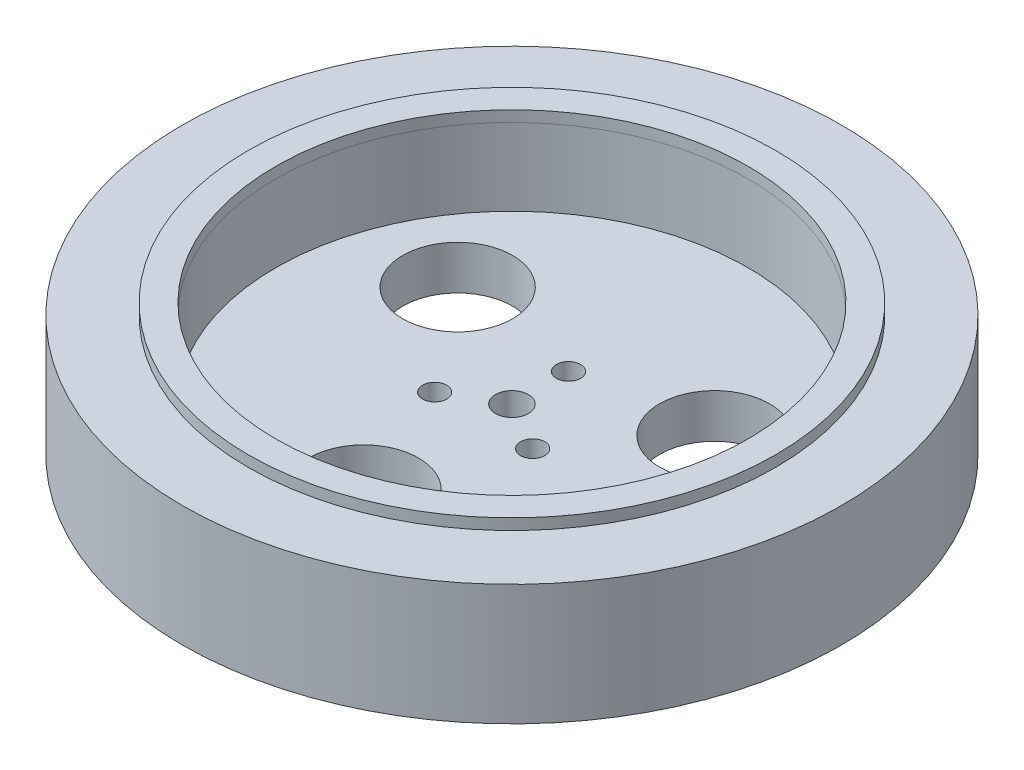
from build123d import *

# Parameters (mm, degrees)
SKETCH_1_R          = 24
EXTRUDE_1_DEPTH     = 12
SKETCH_2_R          = 21.5
CUT_EXTRUDE_3_DEPTH = 7
SKETCH_3_R          = 1.1
SKETCH_3_R_2        = 1.5
CUT_EXTRUDE_4_DEPTH = 35.655446902
SKETCH_5_R          = 30
SKETCH_5_R_2        = 24
EXTRUDE_2_DEPTH     = 11
SKETCH_7_R          = 24
CUT_EXTRUDE_6_DEPTH = 1
SKETCH_8_R          = 24
SKETCH_8_R_2        = 21.5
EXTRUDE_4_DEPTH     = 1
SKETCH_4_R          = 5
CUT_EXTRUDE_8_DEPTH = 44.17406629


with BuildPart() as part:
    # 草图1 → 凸台-拉伸1 (new body)
    with BuildSketch(Plane(origin=(0, 0, 0), x_dir=(1, 0, 0), z_dir=(0, 1, 0))):
        with Locations(Location((0, 0, 0), (0, 0, 270))):
            Circle(SKETCH_1_R)
    extrude(amount=EXTRUDE_1_DEPTH)

    # 草图2 → 切除-拉伸3 (cut)
    with BuildSketch(Plane(origin=(0, 12, 0), x_dir=(1, 0, 0), z_dir=(0, 1, 0))):
        with Locations(Location((0, 0, 0), (0, 0, 270))):
            Circle(SKETCH_2_R)
    extrude(amount=-CUT_EXTRUDE_3_DEPTH, mode=Mode.SUBTRACT)

    # 草图3 → 切除-拉伸4 (cut, through all)
    with BuildSketch(Plane(origin=(0, 5, 0), x_dir=(1, 0, 0), z_dir=(0, 1, 0))):
        with Locations(Location((0, 5.15, 0), (0, 0, 270))):
            Circle(SKETCH_3_R)
        with Locations(Location((4.460030829, -2.575, 0), (0, 0, 270))):
            Circle(SKETCH_3_R)
        with Locations(Location((-4.460030829, -2.575, 0), (0, 0, 270))):
            Circle(SKETCH_3_R)
        with Locations(Location((0, 0, 0), (0, 0, 270))):
            Circle(SKETCH_3_R_2)
    extrude(amount=-CUT_EXTRUDE_4_DEPTH, mode=Mode.SUBTRACT)

    # 草图7 → 切除-拉伸6 (cut)
    with BuildSketch(Plane.XZ):
        with Locations(Location((0, 0, 0), (0, 0, 90))):
            Circle(SKETCH_7_R)
    extrude(amount=-CUT_EXTRUDE_6_DEPTH, mode=Mode.SUBTRACT)

    # 草图4 → 切除-拉伸8 (cut, through all)
    with BuildSketch(Plane(origin=(0, 5, 0), x_dir=(1, 0, 0), z_dir=(0, 1, 0))):
        with Locations(Location((-11.691342951, 6.75, 0), (0, 0, 270))):
            Circle(SKETCH_4_R)
        with Locations(Location((11.691342951, 6.75, 0), (0, 0, 270))):
            Circle(SKETCH_4_R)
        with Locations(Location((0, -13.5, 0), (0, 0, 270))):
            Circle(SKETCH_4_R)
    extrude(amount=-CUT_EXTRUDE_8_DEPTH, mode=Mode.SUBTRACT)


with BuildPart() as body_2:
    # 草图5 → 凸台-拉伸2 (new body)
    with BuildSketch(Plane(origin=(0, 12, 0), x_dir=(1, 0, 0), z_dir=(0, 1, 0))):
        with Locations(Location((0, 0, 0), (0, 0, 270))):
            Circle(SKETCH_5_R)
        with Locations(Location((0, 0, 0), (0, 0, 270))):
            Circle(SKETCH_5_R_2, mode=Mode.SUBTRACT)
    extrude(amount=-EXTRUDE_2_DEPTH)


with BuildPart() as body_3:
    # 草图8 → 凸台-拉伸4 (new body)
    with BuildSketch(Plane(origin=(0, 12, 0), x_dir=(1, 0, 0), z_dir=(0, 1, 0))):
        with Locations(Location((0, 0, 0), (0, 0, 270))):
            Circle(SKETCH_8_R)
        with Locations(Location((0, 0, 0), (0, 0, 270))):
            Circle(SKETCH_8_R_2, mode=Mode.SUBTRACT)
    extrude(amount=EXTRUDE_4_DEPTH)


solid = Compound([part.part, body_2.part, body_3.part])
